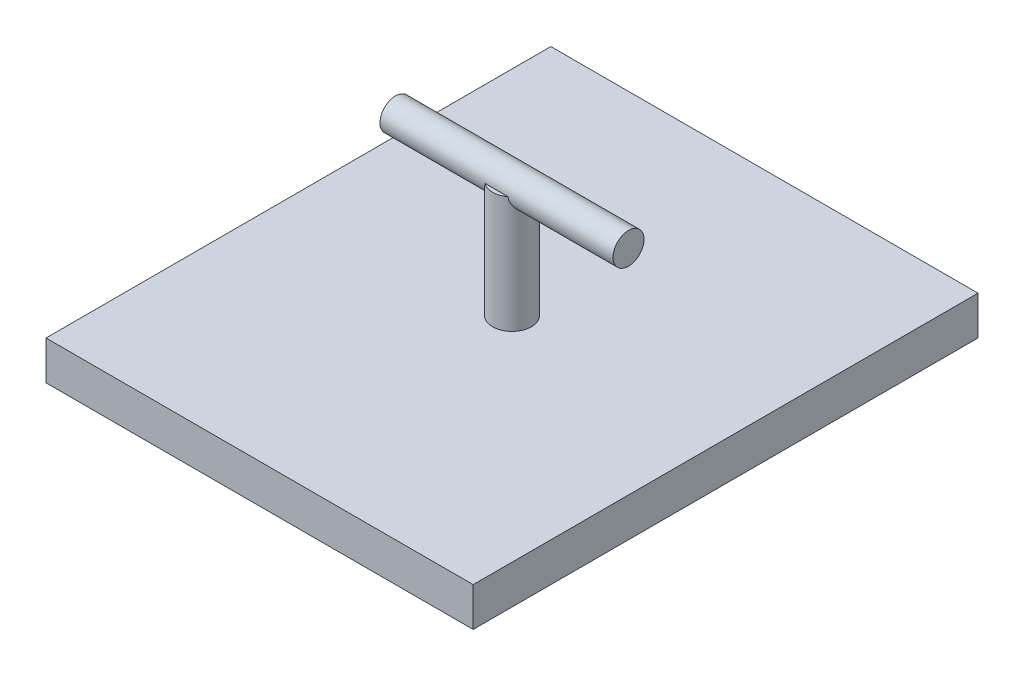
from build123d import *

# Parameters (mm, degrees)
SKETCH_1_W      = 60
SKETCH_1_H      = 4
SKETCH_3_R      = 5
EXTRUDE_2_DEPTH = 30
SKETCH_5_W      = 110
SKETCH_5_H      = 130
EXTRUDE_3_DEPTH = 10


with BuildPart() as part:
    # 草图1 → 旋转3 (revolve)
    with BuildSketch(Plane(origin=(0, 0, 0), x_dir=(1, 0, 0), z_dir=(0, 1, 0)), mode=Mode.PRIVATE) as revolve_3_sk:
        with Locations((0, 2)):
            Rectangle(SKETCH_1_W, SKETCH_1_H)
    revolve(revolve_3_sk.sketch.rotate(Axis((-30, 0, 0), (1, 0, 0)), 180), axis=Axis((-30, 0, 0), (1, 0, 0)))

    # 草图3 → 凸台-拉伸2 (add)
    with BuildSketch(Plane(origin=(0, 0, 0), x_dir=(1, 0, 0), z_dir=(0, 1, 0))):
        with Locations(Location((0, 0, 0), (0, 0, 270))):
            Circle(SKETCH_3_R)
    extrude(amount=-EXTRUDE_2_DEPTH)

    # 草图5 → 凸台-拉伸3 (add)
    with BuildSketch(Plane.XZ.offset(30)):
        Rectangle(SKETCH_5_W, SKETCH_5_H)
    extrude(amount=EXTRUDE_3_DEPTH)


solid = part.part
